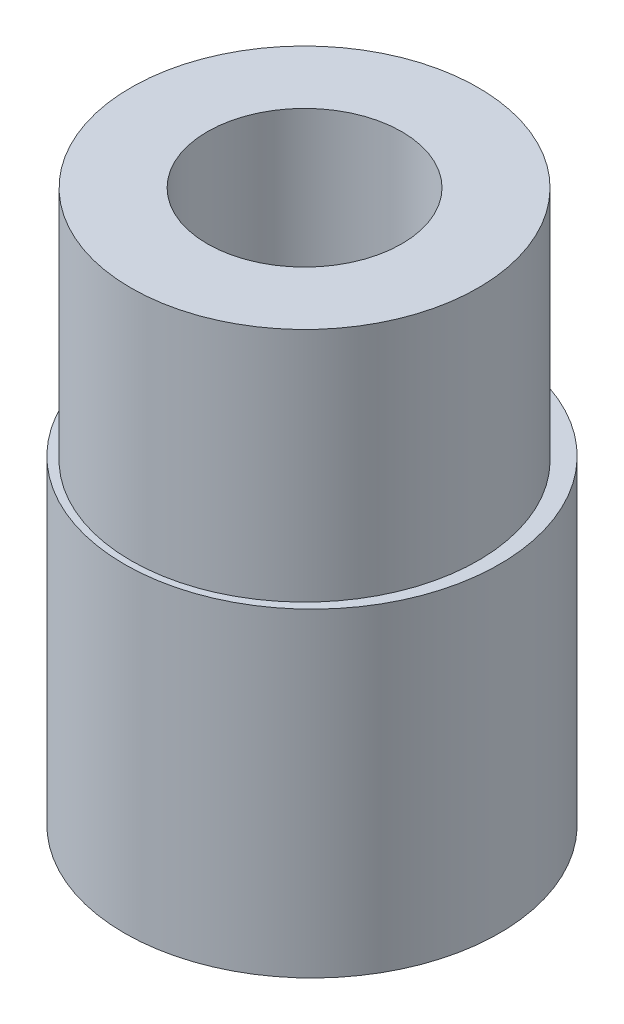
from build123d import *

# Parameters (mm, degrees)
SKETCH1_R           = 3.175
BOSS_EXTRUDE1_DEPTH = 4.318
SKETCH2_R           = 1.778
CUT_EXTRUDE1_DEPTH  = 3.048
SKETCH4_R           = 3.429
BOSS_EXTRUDE2_DEPTH = 5.842
SKETCH5_R           = 2.794
CUT_EXTRUDE2_DEPTH  = 4.826


with BuildPart() as part:
    # Sketch1 → Boss-Extrude1 (new body)
    with BuildSketch(Plane(origin=(0, 0, 0), x_dir=(1, 0, 0), z_dir=(0, 1, 0))):
        with Locations(Location((0, 0, 0), (0, 0, 270))):
            Circle(SKETCH1_R)
    extrude(amount=BOSS_EXTRUDE1_DEPTH)

    # Sketch2 → Cut-Extrude1 (cut)
    with BuildSketch(Plane(origin=(0, 4.318, 0), x_dir=(1, 0, 0), z_dir=(0, 1, 0))):
        with Locations(Location((0, 0, 0), (0, 0, 270))):
            Circle(SKETCH2_R)
    extrude(amount=-CUT_EXTRUDE1_DEPTH, mode=Mode.SUBTRACT)

    # Sketch4 → Boss-Extrude2 (add)
    with BuildSketch(Plane.XZ):
        with Locations(Location((0, -0.136069794, 0), (0, 0, 270))):
            Circle(SKETCH4_R)
    extrude(amount=BOSS_EXTRUDE2_DEPTH)

    # Sketch5 → Cut-Extrude2 (cut)
    with BuildSketch(Plane.XZ.offset(5.842)):
        with Locations(Location((0, 0, 0), (0, 0, 270))):
            Circle(SKETCH5_R)
    extrude(amount=-CUT_EXTRUDE2_DEPTH, mode=Mode.SUBTRACT)


solid = part.part
